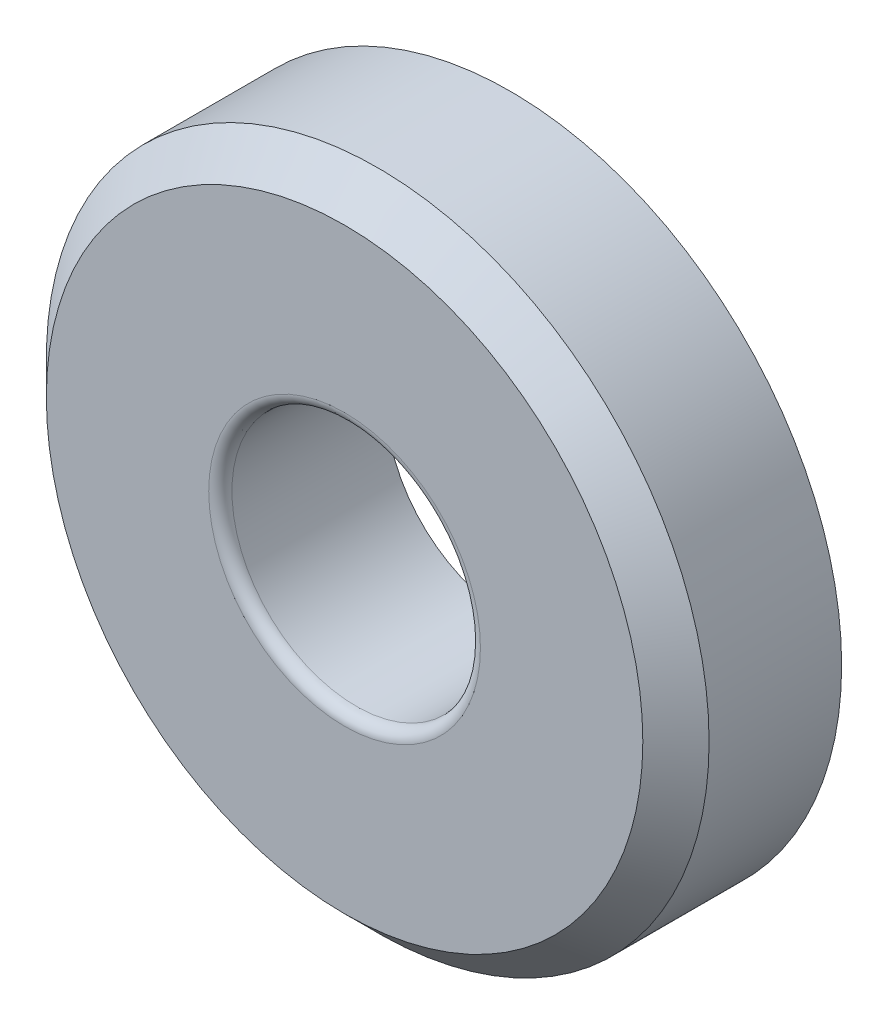
from build123d import *

# Parameters (mm, degrees)
SKETCH2_R           = 25.4
SKETCH2_R_2         = 9.525
BOSS_EXTRUDE1_DEPTH = 12.7
CHAMFER1_SIZE       = 2.54
FILLET1_R           = 0.889


with BuildPart() as part:
    # Sketch2 → Boss-Extrude1 (new body)
    with BuildSketch(Plane.XY):
        Circle(SKETCH2_R)
        Circle(SKETCH2_R_2, mode=Mode.SUBTRACT)
    extrude(amount=BOSS_EXTRUDE1_DEPTH)

    # Chamfer1
    chamfer1_edges = [part.edges().sort_by_distance(p)[0] for p in [
        (-25.4, 0, 12.7),
    ]]
    chamfer(chamfer1_edges, length=CHAMFER1_SIZE)

    # Fillet1
    fillet1_edges = [part.edges().sort_by_distance(p)[0] for p in [
        (-9.525, 0, 12.7),
    ]]
    fillet(fillet1_edges, radius=FILLET1_R)


solid = part.part
